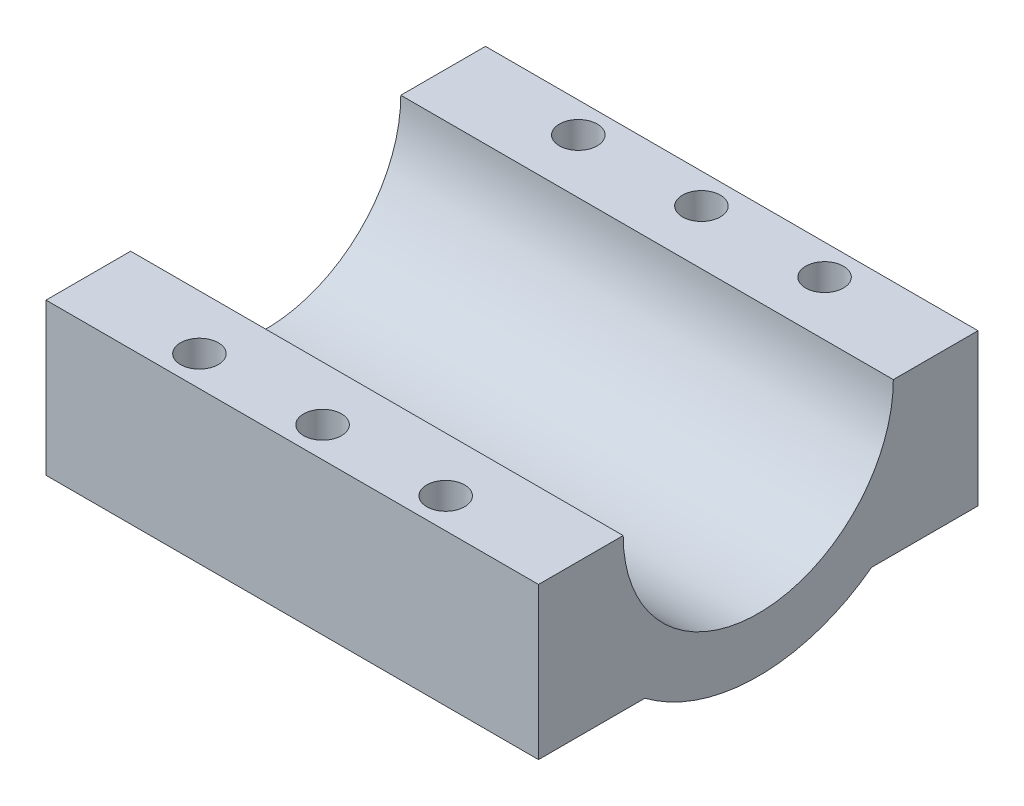
from build123d import *

# Parameters (mm, degrees)
SKETCH1_W           = 65
SKETCH1_H           = 58
SKETCH1_R           = 2.5
BOSS_EXTRUDE1_DEPTH = 25
SKETCH2_R           = 17.825
CUT_EXTRUDE1_DEPTH  = 76.43871685


with BuildPart() as part:
    # Sketch1 → Boss-Extrude1 (new body)
    with BuildSketch(Plane(origin=(0, 0, 0), x_dir=(1, 0, 0), z_dir=(0, 1, 0))):
        Rectangle(SKETCH1_W, SKETCH1_H)
        with Locations(Location((-16.25, 25, 0), (0, 0, 270))):
            Circle(SKETCH1_R, mode=Mode.SUBTRACT)
        with Locations(Location((16.25, 25, 0), (0, 0, 270))):
            Circle(SKETCH1_R, mode=Mode.SUBTRACT)
        with Locations(Location((16.25, -25, 0), (0, 0, 90))):
            Circle(SKETCH1_R, mode=Mode.SUBTRACT)
        with Locations(Location((-16.25, -25, 0), (0, 0, 90))):
            Circle(SKETCH1_R, mode=Mode.SUBTRACT)
        with Locations(Location((0, 25, 0), (0, 0, 270))):
            Circle(SKETCH1_R, mode=Mode.SUBTRACT)
        with Locations(Location((0, -25, 0), (0, 0, 270))):
            Circle(SKETCH1_R, mode=Mode.SUBTRACT)
    extrude(amount=BOSS_EXTRUDE1_DEPTH)

    # Sketch2 → Cut-Extrude1 (cut, through all)
    with BuildSketch(Plane(origin=(32.5, 0, 0), x_dir=(0, 0, -1), z_dir=(1, 0, 0))):
        with Locations((0, 25)):
            Circle(SKETCH2_R)
        with BuildLine():
            Line((-14.963830053, 4.972923575), (-29, 4.972923575))
            Line((-29, 4.972923575), (-29, -6.793967085))
            Line((-29, -6.793967085), (29, -6.793967085))
            Line((29, -6.793967085), (29, 4.972923575))
            Line((29, 4.972923575), (14.963830053, 4.972923575))
            ThreePointArc((14.963830053, 4.972923575), (0, 0), (-14.963830053, 4.972923575))
        make_face()
    extrude(amount=-CUT_EXTRUDE1_DEPTH, mode=Mode.SUBTRACT)


solid = part.part
